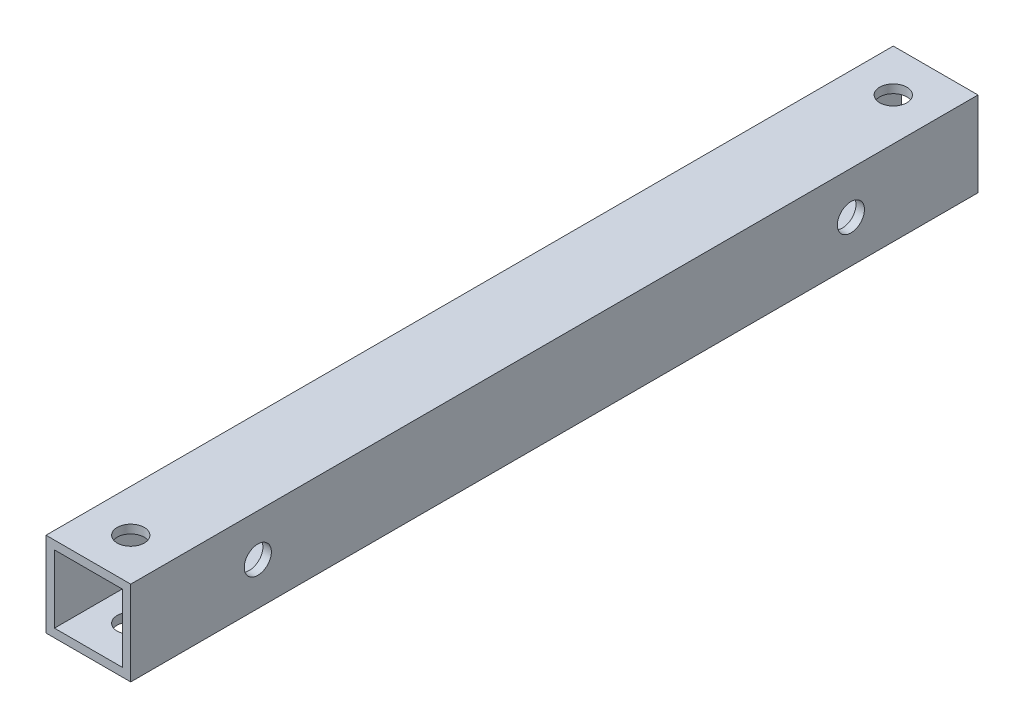
from build123d import *

# Parameters (mm, degrees)
SKETCH_1_W          = 10
SKETCH_1_H          = 10
SKETCH_1_W_2        = 8
SKETCH_1_H_2        = 8
EXTRUDE_1_DEPTH     = 100
SKETCH_2_R          = 1.6
CUT_EXTRUDE_1_DEPTH = 101.623058987
SKETCH_3_R          = 1.6
CUT_EXTRUDE_2_DEPTH = 100


with BuildPart() as part:
    # ｽｹｯﾁ1 → ﾎﾞｽ - 押し出し1 (new body)
    with BuildSketch(Plane.XY):
        Rectangle(SKETCH_1_W, SKETCH_1_H)
        Rectangle(SKETCH_1_W_2, SKETCH_1_H_2, mode=Mode.SUBTRACT)
    extrude(amount=EXTRUDE_1_DEPTH)

    # ｽｹｯﾁ2 → ｶｯﾄ - 押し出し1 (cut, through all)
    with BuildSketch(Plane(origin=(5, 0, 0), x_dir=(0, 0, -1), z_dir=(1, 0, 0))):
        with Locations(Location((-85, 0, 0), (0, 0, 90))):
            Circle(SKETCH_2_R)
        with Locations(Location((-15, 0, 0), (0, 0, 90))):
            Circle(SKETCH_2_R)
    extrude(amount=-CUT_EXTRUDE_1_DEPTH, mode=Mode.SUBTRACT)

    # ｽｹｯﾁ3 → ｶｯﾄ - 押し出し2 (cut)
    with BuildSketch(Plane(origin=(0, 5, 0), x_dir=(1, 0, 0), z_dir=(0, 1, 0))):
        with Locations(Location((0, -95, 0), (0, 0, 270))):
            Circle(SKETCH_3_R)
        with Locations(Location((0, -5, 0), (0, 0, 270))):
            Circle(SKETCH_3_R)
    extrude(amount=-CUT_EXTRUDE_2_DEPTH, mode=Mode.SUBTRACT)


solid = part.part
